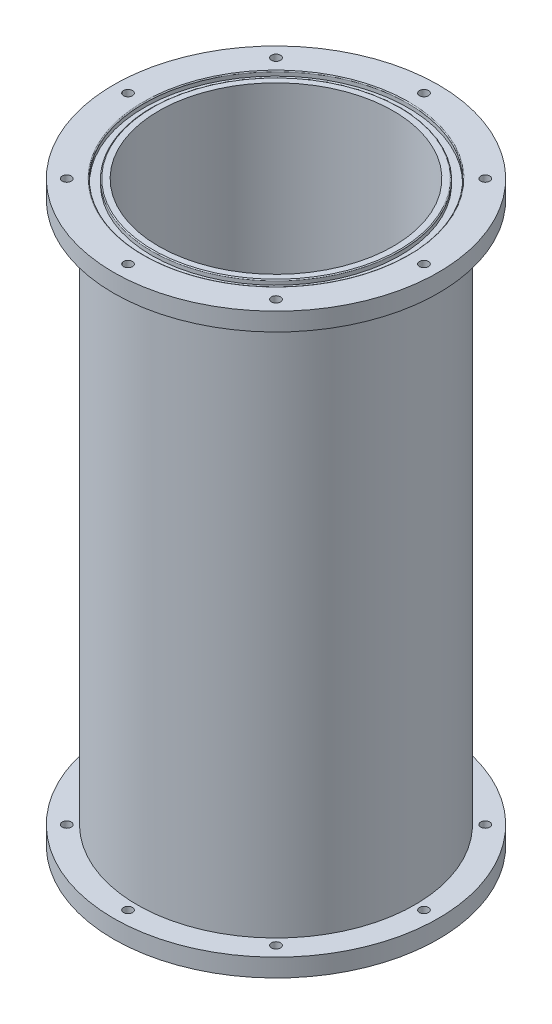
from build123d import *

# Parameters (mm, degrees)
SKETCH3_R             = 38.5
SKETCH3_R_2           = 32.5
BOSS_EXTRUDE3_DEPTH   = 160
SKETCH5_R             = 36.7411
SKETCH5_R_2           = 35.6743
SKETCH5_R_3           = 34.6075
CUT_EXTRUDE1_DEPTH    = 1.4224
SKETCH5_4_R           = 45
SKETCH5_4_R_2         = 38.5
BOSS_EXTRUDE5_DEPTH   = 5
SKETCH7_R             = 1.55
CUT_EXTRUDE2_DEPTH    = 5
CUT_EXTRUDE3_START    = -80
SKETCH9_R             = 38.5
SKETCH9_R_2           = 32.5
CUT_EXTRUDE3_DEPTH    = 80
CUT_EXTRUDE6_START    = -1.4224
SKETCH5_7_R           = 36.7411
SKETCH5_7_R_2         = 35.6743
SKETCH5_7_R_3         = 34.6075
CUT_EXTRUDE6_DEPTH    = 1.4224
SKETCH10_R            = 36.7411
SKETCH10_R_2          = 34.6075
BOSS_EXTRUDE6_DEPTH   = 160
SKETCH11_R            = 36.5633
SKETCH11_R_2          = 34.4043
CUT_EXTRUDE7_DEPTH    = 1.27
CUT_EXTRUDE8_START    = -1.27
SKETCH12_R            = 36.5633
SKETCH12_R_2          = 34.4043
CUT_EXTRUDE8_DEPTH    = 1.27
SKETCH15_R            = 45
SKETCH15_R_2          = 36.5633
BOSS_EXTRUDE7_DEPTH   = 5
BOSS_EXTRUDE8_START   = -5
SKETCH16_R            = 45
SKETCH16_R_2          = 36.5633
BOSS_EXTRUDE8_DEPTH   = 5
FILLET1_R             = 0.254
M3_TAPPED_HOLE2_D     = 2.5
M3_TAPPED_HOLE2_DEPTH = 5
M3_TAPPED_HOLE2_TIP   = 0.751075774
M3_TAPPED_HOLE3_D     = 2.5
M3_TAPPED_HOLE3_DEPTH = 5
M3_TAPPED_HOLE3_TIP   = 0.751075774


with BuildPart() as part:
    # Sketch3 → Boss-Extrude3 (new body)
    with BuildSketch(Plane(origin=(0, 0, 0), x_dir=(1, 0, 0), z_dir=(0, 1, 0))):
        with Locations(Location((0, 0, 0), (0, 0, 270))):
            Circle(SKETCH3_R)
        with Locations(Location((0, 0, 0), (0, 0, 270))):
            Circle(SKETCH3_R_2, mode=Mode.SUBTRACT)
    boss_extrude3 = extrude(amount=BOSS_EXTRUDE3_DEPTH)

    # Sketch5 → Cut-Extrude1 (cut)
    # profile 1 of 2: a face of its own
    with BuildSketch(Plane.XZ):
        with Locations(Location((0, 0, 0), (0, 0, 270))):
            Circle(SKETCH5_R)
        Circle(SKETCH5_R_2, mode=Mode.SUBTRACT)
    # profile 2 of 2: a face of its own
    with BuildSketch(Plane.XZ):
        Circle(SKETCH5_R_2)
        with Locations(Location((0, 0, 0), (0, 0, 270))):
            Circle(SKETCH5_R_3, mode=Mode.SUBTRACT)
    cut_extrude1 = extrude(amount=-CUT_EXTRUDE1_DEPTH, mode=Mode.SUBTRACT)

    # Sketch5<4> → Boss-Extrude5 (add)
    with BuildSketch(Plane.XZ):
        with Locations(Location((0, 0, 0), (0, 0, 270))):
            Circle(SKETCH5_4_R)
        with Locations(Location((0, 0, 0), (0, 0, 270))):
            Circle(SKETCH5_4_R_2, mode=Mode.SUBTRACT)
    boss_extrude5 = extrude(amount=-BOSS_EXTRUDE5_DEPTH)

    # Sketch7 → Cut-Extrude2 (cut)
    with BuildSketch(Plane(origin=(0, 5, 0), x_dir=(1, 0, 0), z_dir=(0, 1, 0))):
        with Locations(Location((0, 41.75, 0), (0, 0, 270))):
            Circle(SKETCH7_R)
        with Locations(Location((29.521708115, 29.521708115, 0), (0, 0, 270))):
            Circle(SKETCH7_R)
        with Locations(Location((41.75, 0, 0), (0, 0, 270))):
            Circle(SKETCH7_R)
        with Locations(Location((29.521708115, -29.521708115, 0), (0, 0, 270))):
            Circle(SKETCH7_R)
        with Locations(Location((0, -41.75, 0), (0, 0, 270))):
            Circle(SKETCH7_R)
        with Locations(Location((-29.521708115, -29.521708115, 0), (0, 0, 270))):
            Circle(SKETCH7_R)
        with Locations(Location((-41.75, 0, 0), (0, 0, 270))):
            Circle(SKETCH7_R)
        with Locations(Location((-29.521708115, 29.521708115, 0), (0, 0, 270))):
            Circle(SKETCH7_R)
    cut_extrude2 = extrude(amount=-CUT_EXTRUDE2_DEPTH, mode=Mode.SUBTRACT)

    # Sketch9 → Cut-Extrude3 (cut)
    with BuildSketch(Plane(origin=(0, 160, 0), x_dir=(1, 0, 0), z_dir=(0, 1, 0)).offset(CUT_EXTRUDE3_START)):
        with Locations(Location((0, 0, 0), (0, 0, 90))):
            Circle(SKETCH9_R)
        with Locations(Location((0, 0, 0), (0, 0, 270))):
            Circle(SKETCH9_R_2, mode=Mode.SUBTRACT)
    extrude(amount=CUT_EXTRUDE3_DEPTH, mode=Mode.SUBTRACT)

    # Mirror7: Boss-Extrude3, Cut-Extrude1, Boss-Extrude5, Cut-Extrude2 across plane
    add(boss_extrude3.mirror(Plane.ZX.offset(80)))
    add(cut_extrude1.mirror(Plane.ZX.offset(80)), mode=Mode.SUBTRACT)
    add(boss_extrude5.mirror(Plane.ZX.offset(80)))
    add(cut_extrude2.mirror(Plane.ZX.offset(80)), mode=Mode.SUBTRACT)

    # Sketch5<7> → Cut-Extrude6 (cut)
    # profile 1 of 2: a face of its own
    with BuildSketch(Plane.XZ.offset(CUT_EXTRUDE6_START)):
        with Locations(Location((0, 0, 0), (0, 0, 270))):
            Circle(SKETCH5_7_R)
        Circle(SKETCH5_7_R_2, mode=Mode.SUBTRACT)
    # profile 2 of 2: a face of its own
    with BuildSketch(Plane.XZ.offset(CUT_EXTRUDE6_START)):
        Circle(SKETCH5_7_R_2)
        with Locations(Location((0, 0, 0), (0, 0, 270))):
            Circle(SKETCH5_7_R_3, mode=Mode.SUBTRACT)
    extrude(amount=CUT_EXTRUDE6_DEPTH, mode=Mode.SUBTRACT)

    # Sketch10 → Boss-Extrude6 (add)
    with BuildSketch(Plane(origin=(0, 160, 0), x_dir=(1, 0, 0), z_dir=(0, 1, 0))):
        Circle(SKETCH10_R)
        Circle(SKETCH10_R_2, mode=Mode.SUBTRACT)
    extrude(amount=-BOSS_EXTRUDE6_DEPTH)

    # Sketch11 → Cut-Extrude7 (cut)
    with BuildSketch(Plane(origin=(0, 160, 0), x_dir=(1, 0, 0), z_dir=(0, 1, 0))):
        with Locations(Location((0, 0, 0), (0, 0, 270))):
            Circle(SKETCH11_R)
        with Locations(Location((0, 0, 0), (0, 0, 270))):
            Circle(SKETCH11_R_2, mode=Mode.SUBTRACT)
    extrude(amount=-CUT_EXTRUDE7_DEPTH, mode=Mode.SUBTRACT)

    # Sketch12 → Cut-Extrude8 (cut)
    with BuildSketch(Plane.XZ.offset(CUT_EXTRUDE8_START)):
        with Locations(Location((0, 0, 0), (0, 0, 90))):
            Circle(SKETCH12_R)
        with Locations(Location((0, 0, 0), (0, 0, 90))):
            Circle(SKETCH12_R_2, mode=Mode.SUBTRACT)
    extrude(amount=CUT_EXTRUDE8_DEPTH, mode=Mode.SUBTRACT)

    # Sketch15 → Boss-Extrude7 (add)
    with BuildSketch(Plane(origin=(0, 160, 0), x_dir=(1, 0, 0), z_dir=(0, 1, 0))):
        with Locations(Location((0, 0, 0), (0, 0, 90))):
            Circle(SKETCH15_R)
        with Locations(Location((0, 0, 0), (0, 0, 270))):
            Circle(SKETCH15_R_2, mode=Mode.SUBTRACT)
    extrude(amount=-BOSS_EXTRUDE7_DEPTH)

    # Sketch16 → Boss-Extrude8 (add)
    with BuildSketch(Plane.XZ.offset(BOSS_EXTRUDE8_START)):
        with Locations(Location((0, 0, 0), (0, 0, 270))):
            Circle(SKETCH16_R)
        with Locations(Location((0, 0, 0), (0, 0, 90))):
            Circle(SKETCH16_R_2, mode=Mode.SUBTRACT)
    extrude(amount=BOSS_EXTRUDE8_DEPTH)

    # Fillet1
    fillet1_edges = [part.edges().sort_by_distance(p)[0] for p in [
        (0, 160, -36.5633),
        (0, 160, -34.4043),
        (0, 0, -36.5633),
        (0, 0, -34.4043),
    ]]
    fillet(fillet1_edges, radius=FILLET1_R)

    # M3 Tapped Hole2
    with Locations(Plane.XZ):
        with Locations((41, 0), (28.991378029, -28.991378029), (0, -41), (-28.991378029, -28.991378029), (-41, 0), (-28.991378029, 28.991378029), (0, 41), (28.991378029, 28.991378029), (0, 0)):
            Hole(M3_TAPPED_HOLE2_D / 2, depth=M3_TAPPED_HOLE2_DEPTH)
            with Locations((0, 0, -(M3_TAPPED_HOLE2_DEPTH + M3_TAPPED_HOLE2_TIP / 2))):  # 118° drill point
                Cone(0, M3_TAPPED_HOLE2_D / 2, M3_TAPPED_HOLE2_TIP, mode=Mode.SUBTRACT)

    # M3 Tapped Hole3
    with Locations(Plane(origin=(0, 160, 0), x_dir=(1, 0, 0), z_dir=(0, 1, 0))):
        with Locations((41, 0), (28.991378029, -28.991378029), (0, -41), (-28.991378029, -28.991378029), (-41, 0), (-28.991378029, 28.991378029), (0, 41), (28.991378029, 28.991378029), (0, 0)):
            Hole(M3_TAPPED_HOLE3_D / 2, depth=M3_TAPPED_HOLE3_DEPTH)
            with Locations((0, 0, -(M3_TAPPED_HOLE3_DEPTH + M3_TAPPED_HOLE3_TIP / 2))):  # 118° drill point
                Cone(0, M3_TAPPED_HOLE3_D / 2, M3_TAPPED_HOLE3_TIP, mode=Mode.SUBTRACT)


solid = part.part
